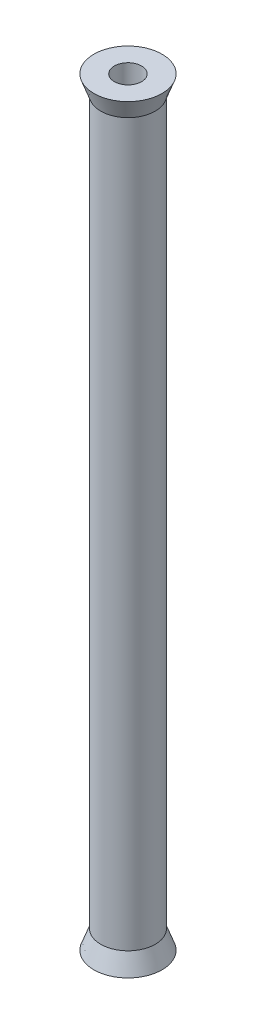
from build123d import *


with BuildPart() as part:
    # Sketch1 → Revolve1 (revolve)
    with BuildSketch(Plane.XY, mode=Mode.PRIVATE) as revolve1_sk:
        Polygon((2, -55.7), (5, -55.7), (4, -52.952522581), (4, 52.952522581), (5, 55.7), (2, 55.7), align=None)
    revolve(revolve1_sk.sketch.rotate(Axis((0, 0, 0), (0, -1, 0)), 90), axis=Axis((0, 0, 0), (0, -1, 0)))


solid = part.part
